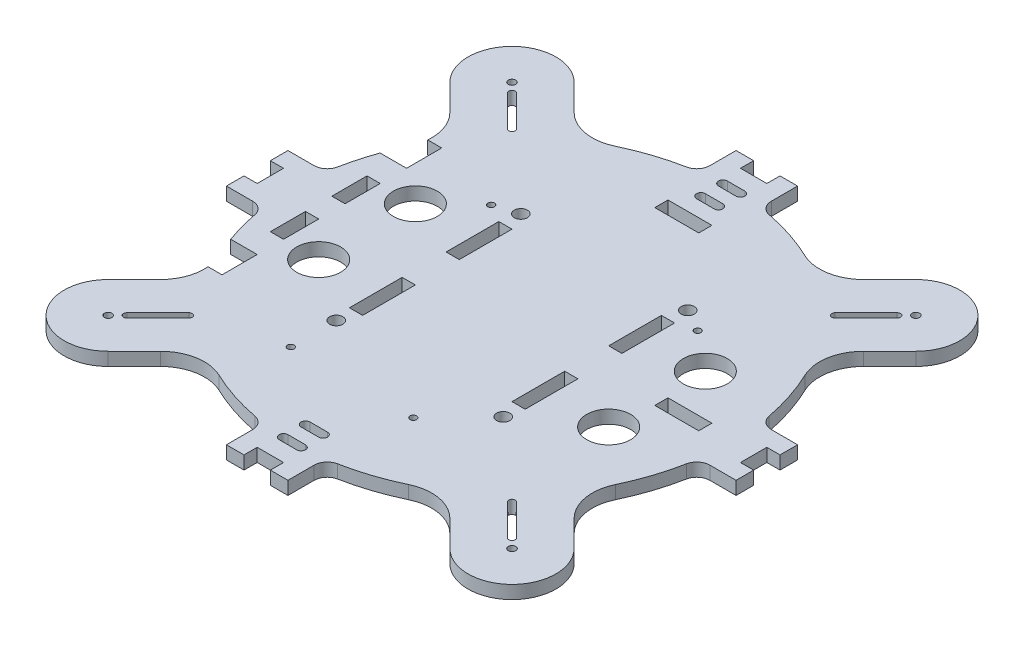
from build123d import *

# Parameters (mm, degrees)
ESQUISSE1_R             = 0.85
ESQUISSE1_R_2           = 1.5
ESQUISSE1_R_3           = 0.75
ESQUISSE1_R_4           = 5
ESQUISSE1_W             = 3
ESQUISSE1_H             = 12
ESQUISSE1_W_2           = 10
ESQUISSE1_H_2           = 3
BOSS_EXTRU_1_DEPTH      = 3
CONG_1_R                = 10
CONG_2_R                = 3
ENL_V_MAT_EXTRU_1_REACH = 84.079
ESQUISSE4_W             = 10
ESQUISSE4_H             = 8
ESQUISSE4_W_2           = 3


with BuildPart() as part:
    # Esquisse1 → Boss.-Extru.1 (new body)
    with BuildSketch(Plane(origin=(0, 0, 0), x_dir=(1, 0, 0), z_dir=(0, 1, 0))):
        with BuildLine():
            Line((-38.890872965, -53.033008589), (-27.56994834, -41.712083963))
            ThreePointArc((-27.56994834, -41.712083963), (-17.718994127, -46.755077234), (-7, -49.507575178))
            Line((-7, -49.507575178), (-7, -58))
            Line((-7, -58), (-3, -58))
            Line((-3, -58), (-3, -55))
            Line((-3, -55), (3, -55))
            Line((3, -55), (3, -58))
            Line((3, -58), (7, -58))
            Line((7, -58), (7, -49.507575178))
            ThreePointArc((7, -49.507575178), (17.718994127, -46.755077234), (27.56994834, -41.712083963))
            Line((27.56994834, -41.712083963), (38.890872965, -53.033008589))
            ThreePointArc((38.890872965, -53.033008589), (53.033008589, -53.033008589), (53.033008589, -38.890872965))
            Line((53.033008589, -38.890872965), (41.712083963, -27.56994834))
            ThreePointArc((41.712083963, -27.56994834), (46.755077234, -17.718994127), (49.507575178, -7))
            Line((49.507575178, -7), (58, -7))
            Line((58, -7), (58, -3))
            Line((58, -3), (55, -3))
            Line((55, -3), (55, 3))
            Line((55, 3), (58, 3))
            Line((58, 3), (58, 7))
            Line((58, 7), (49.507575178, 7))
            ThreePointArc((49.507575178, 7), (46.755077234, 17.718994127), (41.712083963, 27.56994834))
            Line((41.712083963, 27.56994834), (53.033008589, 38.890872965))
            ThreePointArc((53.033008589, 38.890872965), (53.033008589, 53.033008589), (38.890872965, 53.033008589))
            Line((38.890872965, 53.033008589), (27.56994834, 41.712083963))
            ThreePointArc((27.56994834, 41.712083963), (17.718994127, 46.755077234), (7, 49.507575178))
            Line((7, 49.507575178), (7, 58))
            Line((7, 58), (3, 58))
            Line((3, 58), (3, 55))
            Line((3, 55), (-3, 55))
            Line((-3, 55), (-3, 58))
            Line((-3, 58), (-7, 58))
            Line((-7, 58), (-7, 49.507575178))
            ThreePointArc((-7, 49.507575178), (-17.718994127, 46.755077234), (-27.56994834, 41.712083963))
            Line((-27.56994834, 41.712083963), (-38.890872965, 53.033008589))
            ThreePointArc((-38.890872965, 53.033008589), (-53.033008589, 53.033008589), (-53.033008589, 38.890872965))
            Line((-53.033008589, 38.890872965), (-41.712083963, 27.56994834))
            ThreePointArc((-41.712083963, 27.56994834), (-46.755077234, 17.718994127), (-49.507575178, 7))
            Line((-49.507575178, 7), (-58, 7))
            Line((-58, 7), (-58, 3))
            Line((-58, 3), (-55, 3))
            Line((-55, 3), (-55, -3))
            Line((-55, -3), (-58, -3))
            Line((-58, -3), (-58, -7))
            Line((-58, -7), (-49.507575178, -7))
            ThreePointArc((-49.507575178, -7), (-46.755077234, -17.718994127), (-41.712083963, -27.56994834))
            Line((-41.712083963, -27.56994834), (-53.033008589, -38.890872965))
            ThreePointArc((-53.033008589, -38.890872965), (-53.033008589, -53.033008589), (-38.890872965, -53.033008589))
        make_face()
        with Locations(Location((-45.961940777, -45.961940777, 0), (0, 0, 270))):
            Circle(ESQUISSE1_R, mode=Mode.SUBTRACT)
        with Locations(Location((-45.961940777, 45.961940777, 0), (0, 0, 270))):
            Circle(ESQUISSE1_R, mode=Mode.SUBTRACT)
        with Locations(Location((45.961940777, 45.961940777, 0), (0, 0, 270))):
            Circle(ESQUISSE1_R, mode=Mode.SUBTRACT)
        with Locations(Location((45.961940777, -45.961940777, 0), (0, 0, 270))):
            Circle(ESQUISSE1_R, mode=Mode.SUBTRACT)
        with Locations(Location((-19, 21, 0), (0, 0, 270))):
            Circle(ESQUISSE1_R_2, mode=Mode.SUBTRACT)
        with Locations(Location((19, 21, 0), (0, 0, 270))):
            Circle(ESQUISSE1_R_2, mode=Mode.SUBTRACT)
        with Locations(Location((19, -21, 0), (0, 0, 270))):
            Circle(ESQUISSE1_R_2, mode=Mode.SUBTRACT)
        with Locations(Location((-19, -21, 0), (0, 0, 270))):
            Circle(ESQUISSE1_R_2, mode=Mode.SUBTRACT)
        with Locations(Location((24.15, 18.1, 0), (0, 0, 270))):
            Circle(ESQUISSE1_R_3, mode=Mode.SUBTRACT)
        with Locations(Location((-24.15, 19.4, 0), (0, 0, 270))):
            Circle(ESQUISSE1_R_3, mode=Mode.SUBTRACT)
        with Locations(Location((-18.95, -31.4, 0), (0, 0, 270))):
            Circle(ESQUISSE1_R_3, mode=Mode.SUBTRACT)
        with Locations(Location((8.95, -31.4, 0), (0, 0, 270))):
            Circle(ESQUISSE1_R_3, mode=Mode.SUBTRACT)
        with Locations(Location((-33, 11, 0), (0, 0, 270))):
            Circle(ESQUISSE1_R_4, mode=Mode.SUBTRACT)
        with Locations(Location((33, 11, 0), (0, 0, 270))):
            Circle(ESQUISSE1_R_4, mode=Mode.SUBTRACT)
        with Locations(Location((33, -11, 0), (0, 0, 270))):
            Circle(ESQUISSE1_R_4, mode=Mode.SUBTRACT)
        with Locations(Location((-33, -11, 0), (0, 0, 270))):
            Circle(ESQUISSE1_R_4, mode=Mode.SUBTRACT)
        with Locations((-18.5, 11)):
            Rectangle(ESQUISSE1_W, ESQUISSE1_H, mode=Mode.SUBTRACT)
        with Locations((18.5, 11)):
            Rectangle(ESQUISSE1_W, ESQUISSE1_H, mode=Mode.SUBTRACT)
        with Locations((18.5, -11)):
            Rectangle(ESQUISSE1_W, ESQUISSE1_H, mode=Mode.SUBTRACT)
        with Locations((-18.5, -11)):
            Rectangle(ESQUISSE1_W, ESQUISSE1_H, mode=Mode.SUBTRACT)
        with BuildLine():
            Line((-44.370950519, -43.310290348), (-37.299882708, -36.239222536))
            ThreePointArc((-37.299882708, -36.239222536), (-36.239222536, -36.239222536), (-36.239222536, -37.299882708))
            Line((-36.239222536, -37.299882708), (-43.310290348, -44.370950519))
            ThreePointArc((-43.310290348, -44.370950519), (-44.370950519, -44.370950519), (-44.370950519, -43.310290348))
        make_face(mode=Mode.SUBTRACT)
        with BuildLine():
            Line((-43.310290348, 44.370950519), (-36.239222536, 37.299882708))
            ThreePointArc((-36.239222536, 37.299882708), (-36.239222536, 36.239222536), (-37.299882708, 36.239222536))
            Line((-37.299882708, 36.239222536), (-44.370950519, 43.310290348))
            ThreePointArc((-44.370950519, 43.310290348), (-44.370950519, 44.370950519), (-43.310290348, 44.370950519))
        make_face(mode=Mode.SUBTRACT)
        with BuildLine():
            Line((44.370950519, 43.310290348), (37.299882708, 36.239222536))
            ThreePointArc((37.299882708, 36.239222536), (36.239222536, 36.239222536), (36.239222536, 37.299882708))
            Line((36.239222536, 37.299882708), (43.310290348, 44.370950519))
            ThreePointArc((43.310290348, 44.370950519), (44.370950519, 44.370950519), (44.370950519, 43.310290348))
        make_face(mode=Mode.SUBTRACT)
        with BuildLine():
            Line((43.310290348, -44.370950519), (36.239222536, -37.299882708))
            ThreePointArc((36.239222536, -37.299882708), (36.239222536, -36.239222536), (37.299882708, -36.239222536))
            Line((37.299882708, -36.239222536), (44.370950519, -43.310290348))
            ThreePointArc((44.370950519, -43.310290348), (44.370950519, -44.370950519), (43.310290348, -44.370950519))
        make_face(mode=Mode.SUBTRACT)
        with BuildLine():
            Line((-2, -44), (2, -44))
            ThreePointArc((2, -44), (3, -45), (2, -46))
            Line((2, -46), (-2, -46))
            ThreePointArc((-2, -46), (-3, -45), (-2, -44))
        make_face(mode=Mode.SUBTRACT)
        with BuildLine():
            Line((-2, -49), (2, -49))
            ThreePointArc((2, -49), (3, -50), (2, -51))
            Line((2, -51), (-2, -51))
            ThreePointArc((-2, -51), (-3, -50), (-2, -49))
        make_face(mode=Mode.SUBTRACT)
        with BuildLine():
            Line((-2, 49), (2, 49))
            ThreePointArc((2, 49), (3, 50), (2, 51))
            Line((2, 51), (-2, 51))
            ThreePointArc((-2, 51), (-3, 50), (-2, 49))
        make_face(mode=Mode.SUBTRACT)
        with BuildLine():
            Line((-2, 44), (2, 44))
            ThreePointArc((2, 44), (3, 45), (2, 46))
            Line((2, 46), (-2, 46))
            ThreePointArc((-2, 46), (-3, 45), (-2, 44))
        make_face(mode=Mode.SUBTRACT)
        with Locations((39, 0)):
            Rectangle(ESQUISSE1_W_2, ESQUISSE1_H_2, mode=Mode.SUBTRACT)
        with Locations((0, 39)):
            Rectangle(ESQUISSE1_W_2, ESQUISSE1_H_2, mode=Mode.SUBTRACT)
    extrude(amount=BOSS_EXTRU_1_DEPTH)

    # Congé1
    cong_1_edges = [part.edges().sort_by_distance(p)[0] for p in [
        (-27.56994834, 1.5, 41.712083963),
        (-41.712083963, 1.5, 27.56994834),
        (-41.712083963, 1.5, -27.56994834),
        (-27.56994834, 1.5, -41.712083963),
        (27.56994834, 1.5, -41.712083963),
        (41.712083963, 1.5, -27.56994834),
        (41.712083963, 1.5, 27.56994834),
        (27.56994834, 1.5, 41.712083963),
    ]]
    fillet(cong_1_edges, radius=CONG_1_R)

    # Congé2
    cong_2_edges = [part.edges().sort_by_distance(p)[0] for p in [
        (7, 1.5, 49.507575178),
        (-7, 1.5, 49.507575178),
        (-49.507575178, 1.5, 7),
        (-49.507575178, 1.5, -7),
        (-7, 1.5, -49.507575178),
        (7, 1.5, -49.507575178),
        (49.507575178, 1.5, -7),
        (49.507575178, 1.5, 7),
    ]]
    fillet(cong_2_edges, radius=CONG_2_R)

    # Esquisse4 → Enlèv. mat.-Extru.1 (cut, up to next)
    with BuildSketch(Plane(origin=(0, 3, 0), x_dir=(1, 0, 0), z_dir=(0, 1, 0)), mode=Mode.PRIVATE) as enl_v_mat_extru_1_sk1:
        with Locations((-46, 21)):
            Rectangle(ESQUISSE4_W, ESQUISSE4_H)
    enl_v_mat_extru_1_tool1 = extrude(enl_v_mat_extru_1_sk1.sketch, amount=-ENL_V_MAT_EXTRU_1_REACH, mode=Mode.PRIVATE) & part.part
    # Esquisse4 → Enlèv. mat.-Extru.1 (cut, up to next)
    with BuildSketch(Plane(origin=(0, 3, 0), x_dir=(1, 0, 0), z_dir=(0, 1, 0)), mode=Mode.PRIVATE) as enl_v_mat_extru_1_sk2:
        with Locations((-42.5, 7)):
            Rectangle(ESQUISSE4_W_2, ESQUISSE4_H)
    enl_v_mat_extru_1_tool2 = extrude(enl_v_mat_extru_1_sk2.sketch, amount=-ENL_V_MAT_EXTRU_1_REACH, mode=Mode.PRIVATE) & part.part
    # Esquisse4 → Enlèv. mat.-Extru.1 (cut, up to next)
    with BuildSketch(Plane(origin=(0, 3, 0), x_dir=(1, 0, 0), z_dir=(0, 1, 0)), mode=Mode.PRIVATE) as enl_v_mat_extru_1_sk3:
        with Locations((-46, -21)):
            Rectangle(ESQUISSE4_W, ESQUISSE4_H)
    enl_v_mat_extru_1_tool3 = extrude(enl_v_mat_extru_1_sk3.sketch, amount=-ENL_V_MAT_EXTRU_1_REACH, mode=Mode.PRIVATE) & part.part
    # Esquisse4 → Enlèv. mat.-Extru.1 (cut, up to next)
    with BuildSketch(Plane(origin=(0, 3, 0), x_dir=(1, 0, 0), z_dir=(0, 1, 0)), mode=Mode.PRIVATE) as enl_v_mat_extru_1_sk4:
        with Locations((-42.5, -7)):
            Rectangle(ESQUISSE4_W_2, ESQUISSE4_H)
    enl_v_mat_extru_1_tool4 = extrude(enl_v_mat_extru_1_sk4.sketch, amount=-ENL_V_MAT_EXTRU_1_REACH, mode=Mode.PRIVATE) & part.part
    add(enl_v_mat_extru_1_tool1.solids().sort_by_distance((-46, 3, -21))[0], mode=Mode.SUBTRACT)
    add(enl_v_mat_extru_1_tool2.solids().sort_by_distance((-42.5, 3, -7))[0], mode=Mode.SUBTRACT)
    add(enl_v_mat_extru_1_tool3.solids().sort_by_distance((-46, 3, 21))[0], mode=Mode.SUBTRACT)
    add(enl_v_mat_extru_1_tool4.solids().sort_by_distance((-42.5, 3, 7))[0], mode=Mode.SUBTRACT)


solid = part.part
